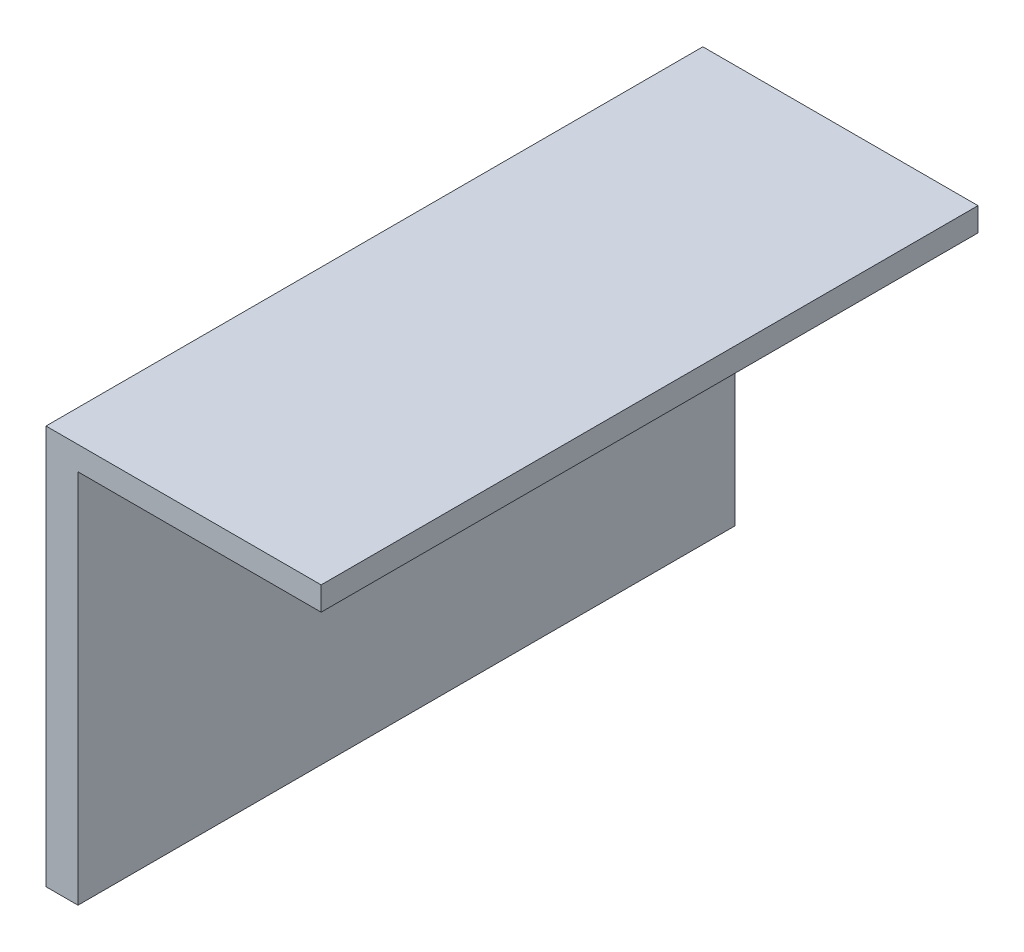
from build123d import *

# Parameters (mm, degrees)
SKETCH1_W           = 52.149348828
SKETCH1_H           = 31.67867156
BOSS_EXTRUDE1_DEPTH = 2.54
SKETCH2_W           = 52.149348828
SKETCH2_H           = 1.878180411
BOSS_EXTRUDE2_DEPTH = 19.304


with BuildPart() as part:
    # Sketch1 → Boss-Extrude1 (new body)
    with BuildSketch(Plane(origin=(0, 0, 0), x_dir=(0, 0, -1), z_dir=(1, 0, 0))):
        with Locations((-23.952143855, 2.54)):
            Rectangle(SKETCH1_W, SKETCH1_H)
    extrude(amount=BOSS_EXTRUDE1_DEPTH)

    # Sketch2 → Boss-Extrude2 (add)
    with BuildSketch(Plane(origin=(2.54, 0, 0), x_dir=(0, 0, -1), z_dir=(1, 0, 0))):
        with Locations((-23.952143855, 17.440245575)):
            Rectangle(SKETCH2_W, SKETCH2_H)
    extrude(amount=BOSS_EXTRUDE2_DEPTH)


solid = part.part
